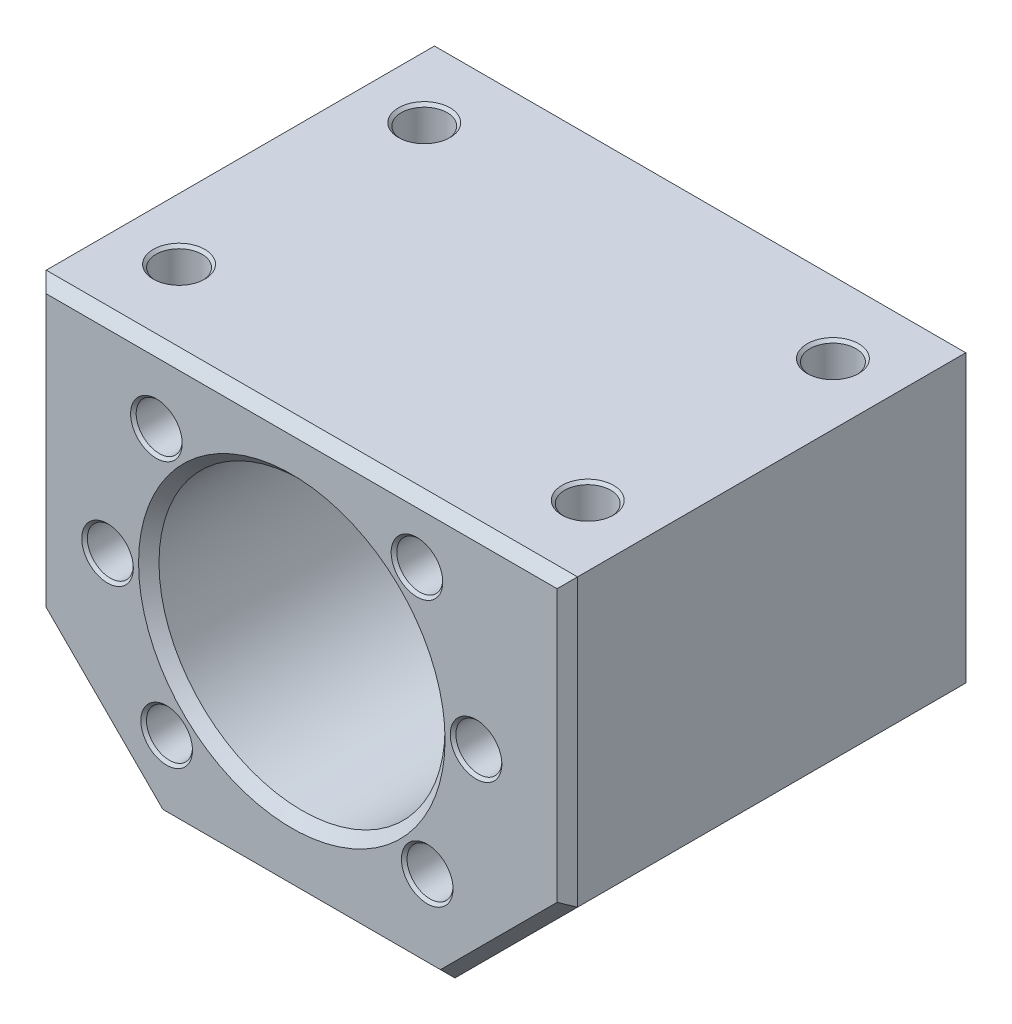
from build123d import *

# Parameters (mm, degrees)
BOSS_EXTRUDE1_DEPTH             = 40
SKETCH2_R                       = 14
CUT_EXTRUDE1_DEPTH              = 40
M5X0_5_TAPPED_HOLE4_D           = 4.5
M5X0_5_TAPPED_HOLE4_DEPTH       = 11.5
M5X0_5_TAPPED_HOLE4_CSINK_D     = 5.05
M5X0_5_TAPPED_HOLE4_CSINK_ANGLE = 90
M5X0_5_TAPPED_HOLE4_TIP         = 1.351936393
CIRPATTERN1_COUNT               = 8
CHAMFER1_SIZE                   = 1
CHAMFER2_SIZE                   = 1


with BuildPart() as part:
    # Sketch1 → Boss-Extrude1 (new body)
    with BuildSketch(Plane.XY):
        Polygon((-49.594358144, 39.126859892), (2.405641856, 39.126859892), (2.405641856, 11.126859892), (-9.594358144, -0.873140108), (-37.594358144, -0.873140108), (-49.594358144, 11.126859892), align=None)
    extrude(amount=BOSS_EXTRUDE1_DEPTH)

    # Sketch2 → Cut-Extrude1 (cut)
    with BuildSketch(Plane.XY.offset(40)):
        with Locations((-24.558993323, 19.837643708)):
            Circle(SKETCH2_R)
    extrude(amount=-CUT_EXTRUDE1_DEPTH, mode=Mode.SUBTRACT)

    # M5x0.5 Tapped Hole4
    with Locations(Plane(origin=(0, 39.126859892, 0), x_dir=(1, 0, 0), z_dir=(0, 1, 0))):
        with Locations((-43.594358144, -32), (-3.594358144, -32), (-3.594358144, -8), (-43.594358144, -8)):
            CounterSinkHole(M5X0_5_TAPPED_HOLE4_D / 2, M5X0_5_TAPPED_HOLE4_CSINK_D / 2, depth=M5X0_5_TAPPED_HOLE4_DEPTH, counter_sink_angle=M5X0_5_TAPPED_HOLE4_CSINK_ANGLE)
            with Locations((0, 0, -(M5X0_5_TAPPED_HOLE4_DEPTH + M5X0_5_TAPPED_HOLE4_TIP / 2))):  # 118° drill point
                Cone(0, M5X0_5_TAPPED_HOLE4_D / 2, M5X0_5_TAPPED_HOLE4_TIP, mode=Mode.SUBTRACT)

    # Sketch15 → M5x0.5 Tapped Hole5 (revolve, cut)
    with BuildSketch(Plane(origin=(-42.594358144, 19.126859892, 40), x_dir=(0, -1, 0), z_dir=(1, 0, 0))):
        Polygon((0, 0), (0, 7.351936393), (2.25, 6), (2.25, 0.275), (2.525, 0), align=None)
    m5x0_5_tapped_hole5 = revolve(axis=Axis((-42.594358144, 19.126859892, 46.35), (0, 0, -1)), mode=Mode.SUBTRACT)

    # CirPattern1: M5x0.5 Tapped Hole5 ×8 about axis, 2 skipped
    cirpattern1_axis = Axis((-24.558993323, 19.837643708, 0), (0, 0, 1))
    add([m5x0_5_tapped_hole5.rotate(cirpattern1_axis, i * 360 / CIRPATTERN1_COUNT) for i in range(1, CIRPATTERN1_COUNT) if i not in (2, 6)], mode=Mode.SUBTRACT)

    # Chamfer1
    chamfer1_edges = [part.edges().sort_by_distance(p)[0] for p in [
        (-23.594358144, -0.873140108, 40),
        (-3.594358144, 5.126859892, 40),
        (2.405641856, 25.126859892, 40),
        (-23.594358144, 39.126859892, 40),
        (-49.594358144, 25.126859892, 40),
        (-23.594358144, 39.126859892, 0),
        (2.405641856, 25.126859892, 0),
        (-3.594358144, 5.126859892, 0),
        (-23.594358144, -0.873140108, 0),
        (-43.594358144, 5.126859892, 0),
        (-49.594358144, 25.126859892, 0),
        (-43.594358144, 5.126859892, 40),
    ]]
    chamfer(chamfer1_edges, length=CHAMFER1_SIZE)

    # Chamfer2
    chamfer2_edges = [part.edges().sort_by_distance(p)[0] for p in [
        (-38.558993323, 19.837643708, 0),
        (-38.558993323, 19.837643708, 40),
    ]]
    chamfer(chamfer2_edges, length=CHAMFER2_SIZE)


solid = part.part
